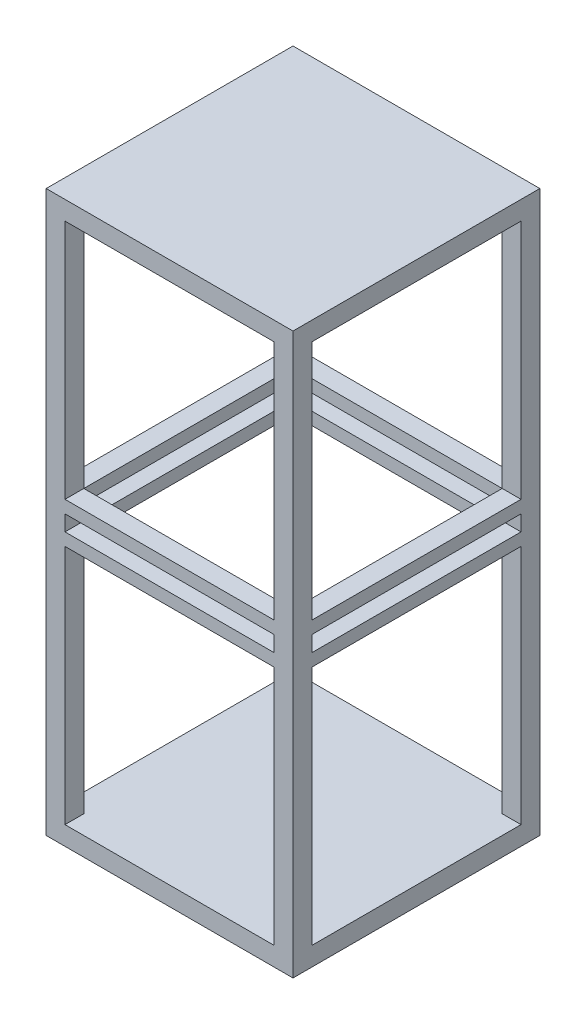
from build123d import *

# Parameters (mm, degrees)
SKETCH1_W           = 100
SKETCH1_H           = 100
BOSS_EXTRUDE1_DEPTH = 227
SKETCH6_W           = 84.76
SKETCH6_H           = 97.625
SKETCH6_H_2         = 6.35
CUT_EXTRUDE3_DEPTH  = 268.44906057
SKETCH10_W          = 84.76
SKETCH10_H          = 97.625
SKETCH10_H_2        = 6.35
CUT_EXTRUDE4_DEPTH  = 268.44906057
SKETCH11_W          = 84.76
SKETCH11_H          = 84.76
CUT_EXTRUDE5_DEPTH  = 25.4


with BuildPart() as part:
    # Sketch1 → Boss-Extrude1 (new body)
    with BuildSketch(Plane(origin=(0, 0, 0), x_dir=(1, 0, 0), z_dir=(0, 1, 0))):
        with Locations((50, 50)):
            Rectangle(SKETCH1_W, SKETCH1_H)
    extrude(amount=BOSS_EXTRUDE1_DEPTH)

    # Sketch6 → Cut-Extrude3 (cut, through all)
    with BuildSketch(Plane(origin=(100, 0, 0), x_dir=(0, 0, -1), z_dir=(1, 0, 0))):
        with Locations((50, 56.4325)):
            Rectangle(SKETCH6_W, SKETCH6_H)
        with Locations((50, 113.5)):
            Rectangle(SKETCH6_W, SKETCH6_H_2)
        with Locations((50, 170.5675)):
            Rectangle(SKETCH6_W, SKETCH6_H)
    extrude(amount=-CUT_EXTRUDE3_DEPTH, mode=Mode.SUBTRACT)

    # Sketch10 → Cut-Extrude4 (cut, through all)
    with BuildSketch(Plane.XY):
        with Locations((50, 170.5675)):
            Rectangle(SKETCH10_W, SKETCH10_H)
        with Locations((50, 113.5)):
            Rectangle(SKETCH10_W, SKETCH10_H_2)
        with Locations((50, 56.4325)):
            Rectangle(SKETCH10_W, SKETCH10_H)
    extrude(amount=-CUT_EXTRUDE4_DEPTH, mode=Mode.SUBTRACT)

    # Sketch11 → Cut-Extrude5 (cut)
    with BuildSketch(Plane(origin=(0, 121.755, 0), x_dir=(1, 0, 0), z_dir=(0, 1, 0))):
        with Locations((50, 50)):
            Rectangle(SKETCH11_W, SKETCH11_H)
    extrude(amount=-CUT_EXTRUDE5_DEPTH, mode=Mode.SUBTRACT)


solid = part.part
